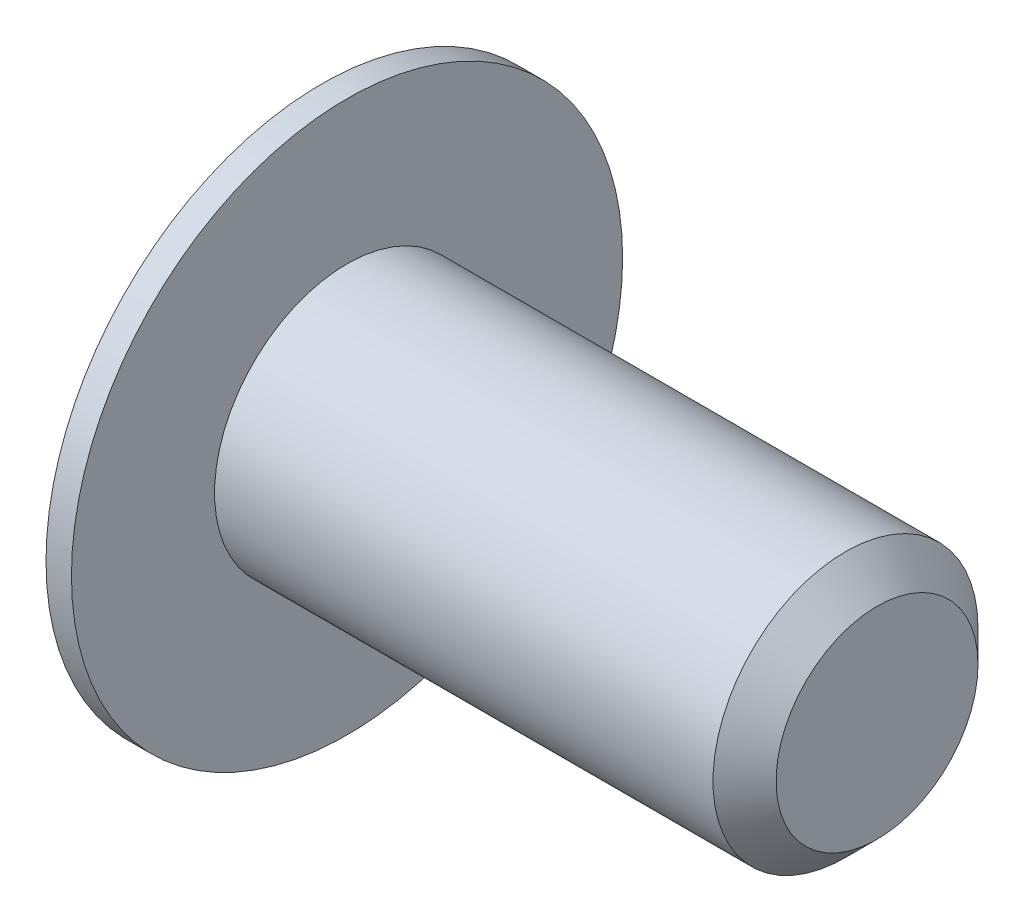
from build123d import *

# Parameters (mm, degrees)
SKETCH2_R           = 3.175
BOSS_EXTRUDE1_DEPTH = 12.7
CUT_EXTRUDE1_DEPTH  = 2.286
CHAMFER1_SIZE       = 0.75565


with BuildPart() as part:
    # Sketch1 → Revolve1 (revolve)
    with BuildSketch(Plane(origin=(0, 0, 0), x_dir=(-1, 0, 0), z_dir=(0, 0, -1)), mode=Mode.PRIVATE) as revolve1_sk:
        with BuildLine():
            Line((0, 6.604), (0, 0))
            Line((0, 0), (3.048, 0))
            Line((3.048, 0), (3.048, 2.4384))
            add(Edge.make_bspline(
                [(0.6096, 5.9436), (1.756478304, 5.100704659), (2.65656918, 3.806824025), (3.048, 2.4384)],
                knots=[0, 0, 0, 0, 1, 1, 1, 1], degree=3))
            Line((0.6096, 5.9436), (0.6096, 6.604))
            Line((0.6096, 6.604), (0, 6.604))
        make_face()
    revolve(revolve1_sk.sketch.rotate(Axis((0, 0, 0), (-1, 0, 0)), 270), axis=Axis((0, 0, 0), (-1, 0, 0)))

    # Sketch2 → Boss-Extrude1 (add)
    with BuildSketch(Plane(origin=(0, 0, 0), x_dir=(0, 0, -1), z_dir=(1, 0, 0))):
        Circle(SKETCH2_R)
    extrude(amount=BOSS_EXTRUDE1_DEPTH)

    # Sketch3 → Cut-Extrude1 (cut)
    with BuildSketch(Plane.ZY.offset(3.048)):
        Polygon((0, -2.346351494), (2.032, -1.173175747), (2.032, 1.173175747), (0, 2.346351494), (-2.032, 1.173175747), (-2.032, -1.173175747), align=None)
    extrude(amount=-CUT_EXTRUDE1_DEPTH, mode=Mode.SUBTRACT)

    # Chamfer1
    chamfer1_edges = [part.edges().sort_by_distance(p)[0] for p in [
        (12.7, 0, 3.175),
    ]]
    chamfer(chamfer1_edges, length=CHAMFER1_SIZE)


solid = part.part
